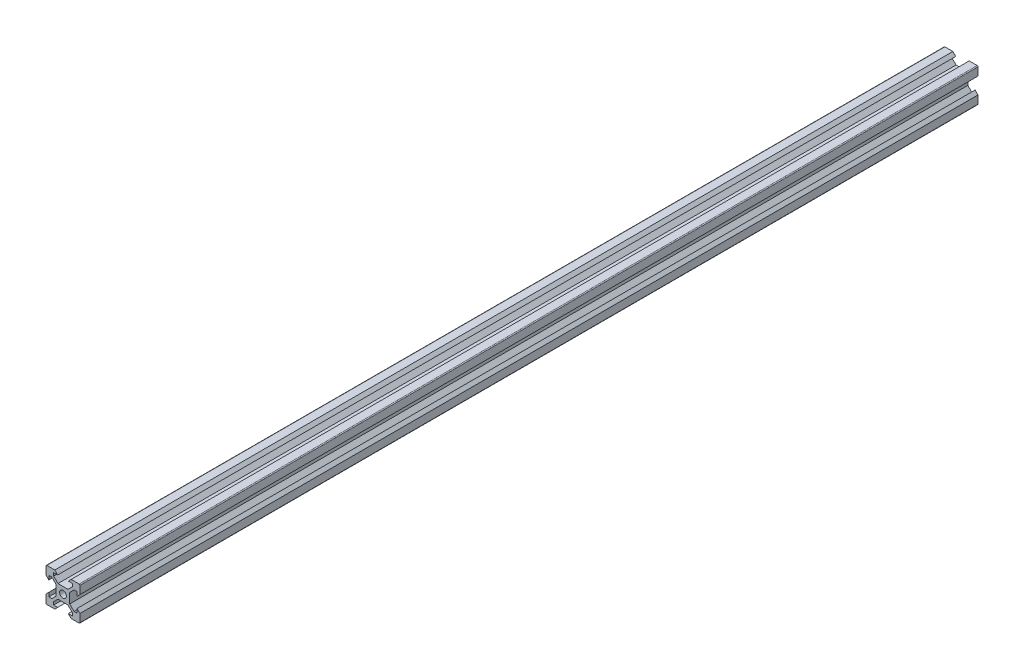
from build123d import *

# Parameters (mm, degrees)
CROQUIS1_R              = 2
SALIENTE_EXTRUIR2_DEPTH = 265


with BuildPart() as part:
    # Croquis1 → Saliente-Extruir2 (new, symmetric)
    with BuildSketch(Plane.XY):
        with BuildLine():
            Line((-4.825, 10), (-3.125, 8.3))
            Line((-3.125, 8.3), (-5.5, 8.3))
            Line((-5.5, 8.3), (-5.5, 6.560660172))
            Line((-5.5, 6.560660172), (-2.939339828, 4))
            Line((-2.939339828, 4), (2.939339828, 4))
            Line((2.939339828, 4), (5.5, 6.560660172))
            Line((5.5, 6.560660172), (5.5, 8.3))
            Line((5.5, 8.3), (3.125, 8.3))
            Line((3.125, 8.3), (4.825, 10))
            Line((4.825, 10), (9.5, 10))
            ThreePointArc((9.5, 10), (9.853553391, 9.853553391), (10, 9.5))
            Line((10, 9.5), (10, 4.825))
            Line((10, 4.825), (8.3, 3.125))
            Line((8.3, 3.125), (8.3, 5.5))
            Line((8.3, 5.5), (6.560660172, 5.5))
            Line((6.560660172, 5.5), (4, 2.939339828))
            Line((4, 2.939339828), (4, -2.939339828))
            Line((4, -2.939339828), (6.560660172, -5.5))
            Line((6.560660172, -5.5), (8.3, -5.5))
            Line((8.3, -5.5), (8.3, -3.125))
            Line((8.3, -3.125), (10, -4.825))
            Line((10, -4.825), (10, -9.5))
            ThreePointArc((10, -9.5), (9.853553391, -9.853553391), (9.5, -10))
            Line((9.5, -10), (4.825, -10))
            Line((4.825, -10), (3.125, -8.3))
            Line((3.125, -8.3), (5.5, -8.3))
            Line((5.5, -8.3), (5.5, -6.560660172))
            Line((5.5, -6.560660172), (2.939339828, -4))
            Line((2.939339828, -4), (-2.939339828, -4))
            Line((-2.939339828, -4), (-5.5, -6.560660172))
            Line((-5.5, -6.560660172), (-5.5, -8.3))
            Line((-5.5, -8.3), (-3.125, -8.3))
            Line((-3.125, -8.3), (-4.825, -10))
            Line((-4.825, -10), (-9.5, -10))
            ThreePointArc((-9.5, -10), (-9.853553391, -9.853553391), (-10, -9.5))
            Line((-10, -9.5), (-10, -4.825))
            Line((-10, -4.825), (-8.3, -3.125))
            Line((-8.3, -3.125), (-8.3, -5.5))
            Line((-8.3, -5.5), (-6.560660172, -5.5))
            Line((-6.560660172, -5.5), (-4, -2.939339828))
            Line((-4, -2.939339828), (-4, 2.939339828))
            Line((-4, 2.939339828), (-6.560660172, 5.5))
            Line((-6.560660172, 5.5), (-8.3, 5.5))
            Line((-8.3, 5.5), (-8.3, 3.125))
            Line((-8.3, 3.125), (-10, 4.825))
            Line((-10, 4.825), (-10, 9.5))
            ThreePointArc((-10, 9.5), (-9.853553391, 9.853553391), (-9.5, 10))
            Line((-9.5, 10), (-4.825, 10))
        make_face()
        Circle(CROQUIS1_R, mode=Mode.SUBTRACT)
    extrude(amount=SALIENTE_EXTRUIR2_DEPTH, both=True)


solid = part.part
